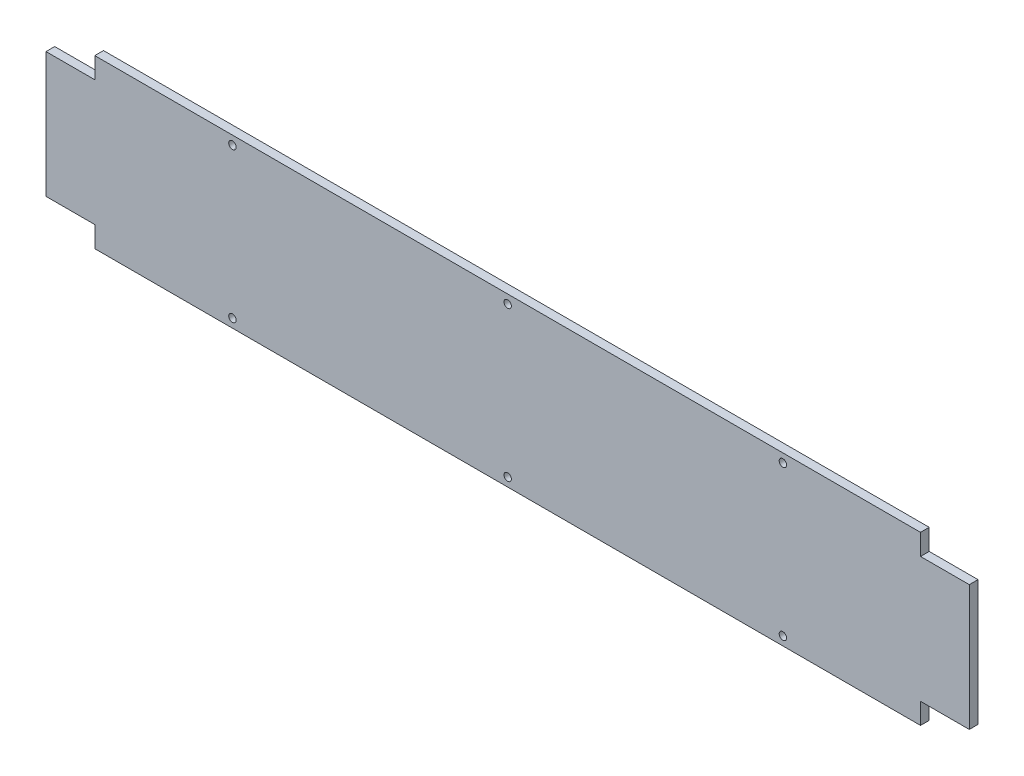
from build123d import *

# Parameters (mm, degrees)
SKETCH1_W           = 474
SKETCH1_H           = 96
BOSS_EXTRUDE1_DEPTH = 5
SKETCH2_R           = 2.125
CUT_EXTRUDE1_DEPTH  = 5
SKETCH3_W           = 28
SKETCH3_H           = 72
BOSS_EXTRUDE2_DEPTH = 5


with BuildPart() as part:
    # Sketch1 → Boss-Extrude1 (new body)
    with BuildSketch(Plane.XY):
        with Locations((237, 48)):
            Rectangle(SKETCH1_W, SKETCH1_H)
    extrude(amount=BOSS_EXTRUDE1_DEPTH)

    # Sketch2 → Cut-Extrude1 (cut)
    with BuildSketch(Plane.XY.offset(5)):
        with Locations((79, 91)):
            Circle(SKETCH2_R)
        with Locations((237, 91)):
            Circle(SKETCH2_R)
        with Locations((395, 91)):
            Circle(SKETCH2_R)
        with Locations(Location((395, 5, 0), (0, 0, 180))):
            Circle(SKETCH2_R)
        with Locations(Location((237, 5, 0), (0, 0, 180))):
            Circle(SKETCH2_R)
        with Locations(Location((79, 5, 0), (0, 0, 180))):
            Circle(SKETCH2_R)
    extrude(amount=-CUT_EXTRUDE1_DEPTH, mode=Mode.SUBTRACT)

    # Sketch3 → Boss-Extrude2 (add)
    with BuildSketch(Plane.XY.offset(5)):
        with Locations((488, 48)):
            Rectangle(SKETCH3_W, SKETCH3_H)
        with Locations((-14, 48)):
            Rectangle(SKETCH3_W, SKETCH3_H)
    extrude(amount=-BOSS_EXTRUDE2_DEPTH)


solid = part.part
